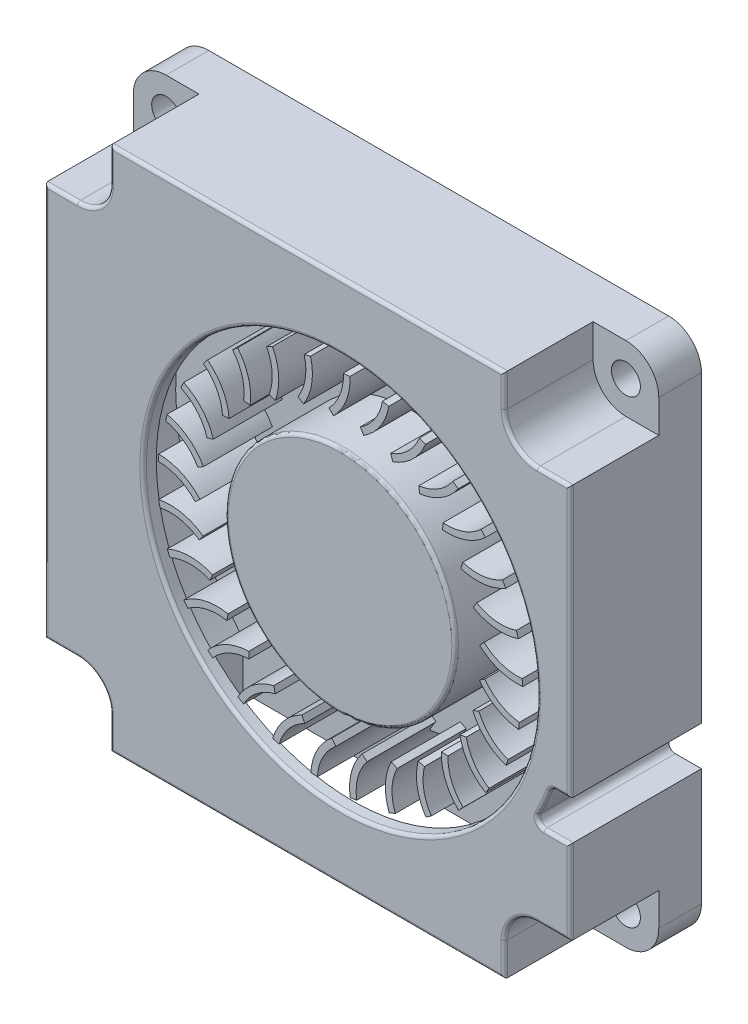
from build123d import *

# Parameters (mm, degrees)
SKETCH1_W                = 40
SKETCH1_H                = 40
BOSS_EXTRUDE1_DEPTH      = 5
SKETCH3_W                = 5
SKETCH3_H                = 5
CUT_EXTRUDE1_DEPTH       = 6.75
FILLET1_R                = 2.5
SKETCH4_R                = 1.1
CUT_EXTRUDE2_DEPTH       = 30.078557392
CIRPATTERN1_COUNT        = 4
FILLET1_OF_CIRPATTERN1_R = 2.5
CUT_EXTRUDE3_DEPTH       = 31
CUT_EXTRUDE5_START       = -1
CUT_EXTRUDE5_DEPTH       = 8
CUT_EXTRUDE6_REACH       = 32
SKETCH2_R                = 15
SKETCH11_R               = 11.75
BOSS_EXTRUDE2_DEPTH      = 3.75
EXTRUDE_THIN1_START      = -2.75
EXTRUDE_THIN1_DEPTH      = 8
CIRPATTERN2_COUNT        = 29
SKETCH13_R               = 8.75
BOSS_EXTRUDE3_DEPTH      = 5.25
FILLET2_R                = 0.25


with BuildPart() as part:
    # Sketch1 → Boss-Extrude1 (new, symmetric)
    with BuildSketch(Plane.XY):
        Rectangle(SKETCH1_W, SKETCH1_H)
    extrude(amount=BOSS_EXTRUDE1_DEPTH, both=True)

    # Sketch3 → Cut-Extrude1 (cut)
    with BuildSketch(Plane.XY.offset(5)):
        with Locations((17.5, 17.5)):
            Rectangle(SKETCH3_W, SKETCH3_H)
    cut_extrude1 = extrude(amount=-CUT_EXTRUDE1_DEPTH, mode=Mode.SUBTRACT)

    # Fillet1
    fillet1_edges = [part.edges().sort_by_distance(p)[0] for p in [
        (20, 20, -3.375),
        (15, 15, 1.625),
    ]]
    fillet(fillet1_edges, radius=FILLET1_R)

    # Sketch4 → Cut-Extrude2 (cut, through all)
    with BuildSketch(Plane.XY.offset(-1.75)):
        with Locations((17.5, 17.5)):
            Circle(SKETCH4_R)
        with Locations((-17.5, 17.5)):
            Circle(SKETCH4_R)
        with Locations((-17.5, -17.5)):
            Circle(SKETCH4_R)
        with Locations((17.5, -17.5)):
            Circle(SKETCH4_R)
    cut_extrude2 = extrude(amount=-CUT_EXTRUDE2_DEPTH, mode=Mode.SUBTRACT)

    # CirPattern1: Cut-Extrude1, Cut-Extrude2 ×4 about axis
    cirpattern1_axis = Axis((0, 0, 0), (0, 0, 1))
    add([cut_extrude1.rotate(cirpattern1_axis, i * 360 / CIRPATTERN1_COUNT) for i in range(1, CIRPATTERN1_COUNT)], mode=Mode.SUBTRACT)
    add([cut_extrude2.rotate(cirpattern1_axis, i * 360 / CIRPATTERN1_COUNT) for i in range(1, CIRPATTERN1_COUNT)], mode=Mode.SUBTRACT)

    # Fillet1 of CirPattern1
    fillet1_of_cirpattern1_edges = [part.edges().sort_by_distance(p)[0] for p in [
        (-20, 20, -3.375),
        (-15, 15, 1.625),
        (-20, -20, -3.375),
        (-15, -15, 1.625),
        (20, -20, -3.375),
        (15, -15, 1.625),
    ]]
    fillet(fillet1_of_cirpattern1_edges, radius=FILLET1_OF_CIRPATTERN1_R)

    # Sketch5 → Cut-Extrude3 (cut, through all)
    with BuildSketch(Plane.XY.offset(5)):
        with BuildLine():
            Line((20, -8.6), (18.012575544, -8.6))
            ThreePointArc((18.012575544, -8.6), (17.584957557, -8.359119388), (17.5693591, -7.868571429))
            ThreePointArc((17.5693591, -7.868571429), (18.031986572, -6.910672408), (18.433797733, -5.925714286))
            ThreePointArc((18.433797733, -5.925714286), (18.617081924, -5.68942549), (18.902438843, -5.6))
            Line((18.902438843, -5.6), (20, -5.6))
            Line((20, -5.6), (20, -8.6))
        make_face()
    extrude(amount=-CUT_EXTRUDE3_DEPTH, mode=Mode.SUBTRACT)

    # Sketch8 → Cut-Extrude5 (cut)
    with BuildSketch(Plane.XY.offset(5).offset(CUT_EXTRUDE5_START)):
        with BuildLine():
            Line((13.9, -20), (13.9, -9.748846086))
            ThreePointArc((13.9, -9.748846086), (17.307066135, -5.339640222), (18.9, 0))
            ThreePointArc((18.9, 0), (13.964466094, 13.964466094), (0, 18.9))
            ThreePointArc((0, 18.9), (-12.789962666, 12.789962666), (-18.9, 0))
            ThreePointArc((-18.9, 0), (-18.073083701, -8.756995061), (-13.9, -16.5))
            Line((-13.9, -16.5), (-13.9, -20))
            Line((-13.9, -20), (13.9, -20))
        make_face()
    extrude(amount=-CUT_EXTRUDE5_DEPTH, mode=Mode.SUBTRACT)

    # Sketch2 → Cut-Extrude6 (cut, up to next)
    with BuildSketch(Plane.XY.offset(5), mode=Mode.PRIVATE) as cut_extrude6_sk1:
        with Locations((2.5, 0)):
            Circle(SKETCH2_R)
    cut_extrude6_tool1 = extrude(cut_extrude6_sk1.sketch, amount=-CUT_EXTRUDE6_REACH, mode=Mode.PRIVATE) & part.part
    add(cut_extrude6_tool1.solids().sort_by_distance((2.5, 0, 5))[0], mode=Mode.SUBTRACT)

    # Sketch11 → Boss-Extrude2 (add)
    with BuildSketch(Plane.XY.offset(-4)):
        with Locations((2.5, 0)):
            Circle(SKETCH11_R)
    extrude(amount=BOSS_EXTRUDE2_DEPTH)

    # Sketch12 → Extrude-Thin1 (add)
    with BuildSketch(Plane.XY.offset(-0.25).offset(EXTRUDE_THIN1_START)):
        with BuildLine():
            ThreePointArc((1.988341465, 10.659708949), (2.955452379, 12.136206602), (3.239334381, 13.878262815))
            Line((3.239334381, 13.878262815), (2.739901549, 13.854454271))
            ThreePointArc((2.739901549, 13.854454271), (2.48941743, 12.317345848), (1.636084271, 11.014553801))
            Line((1.636084271, 11.014553801), (1.988341465, 10.659708949))
        make_face()
    extrude_thin1 = extrude(amount=EXTRUDE_THIN1_DEPTH)

    # CirPattern2: Extrude-Thin1 ×29 about axis
    cirpattern2_axis = Axis((2.5, 0, 0), (0, 0, 1))
    for i in range(1, CIRPATTERN2_COUNT):
        add(extrude_thin1.rotate(cirpattern2_axis, i * 360 / CIRPATTERN2_COUNT))

    # Sketch13 → Boss-Extrude3 (add)
    with BuildSketch(Plane.XY.offset(-0.25)):
        with Locations((2.5, 0)):
            Circle(SKETCH13_R)
    extrude(amount=BOSS_EXTRUDE3_DEPTH)

    # Fillet2
    fillet2_edges = [part.edges().sort_by_distance(p)[0] for p in [
        (0, 20, 5),
        (20, 4.7, 5),
        (19.451219422, -5.6, 5),
        (18.617081924, -5.68942549, 5),
        (18.031986572, -6.910672408, 5),
        (17.584957557, -8.359119388, 5),
        (19.006287772, -8.6, 5),
        (-12.5, 0, 5),
        (15, 18.75, 5),
        (18.75, 15, 5),
        (15.732233047, 15.732233047, 5),
        (-20, 0, 5),
        (0, -20, 5),
        (20, -11.8, 5),
        (-6.25, 0, 5),
        (-18.75, 15, 5),
        (-15, 18.75, 5),
        (-15.732233047, 15.732233047, 5),
        (-15, -18.75, 5),
        (-18.75, -15, 5),
        (-15.732233047, -15.732233047, 5),
        (18.75, -15, 5),
        (15, -18.75, 5),
        (15.732233047, -15.732233047, 5),
    ]]
    fillet(fillet2_edges, radius=FILLET2_R)


solid = part.part
